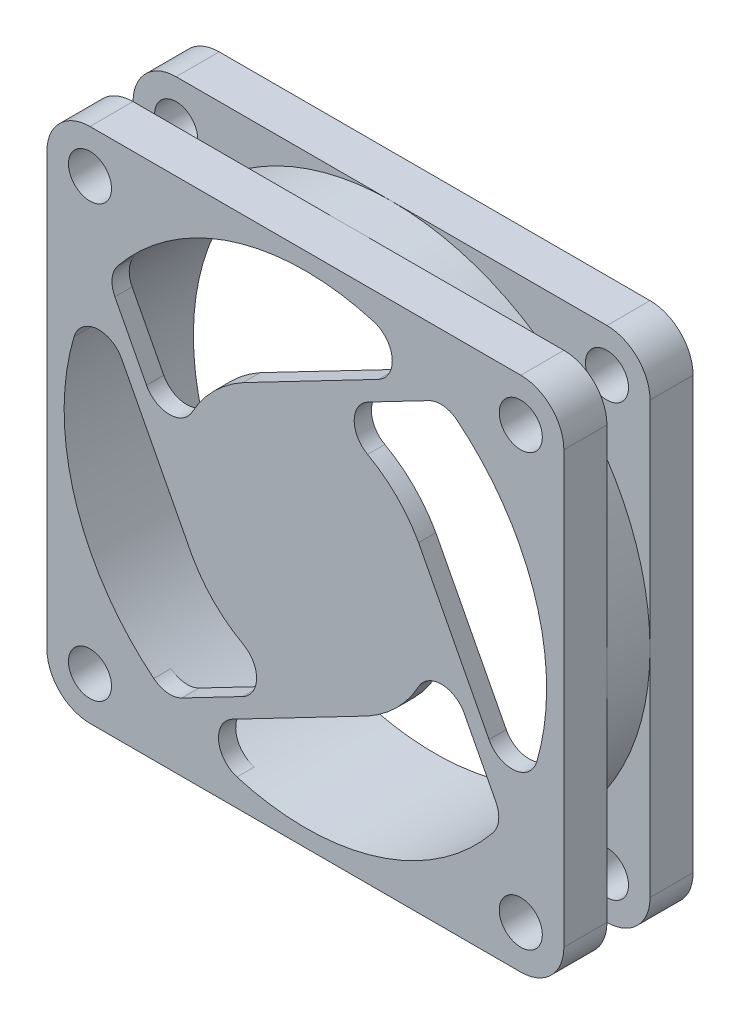
from build123d import *

# Parameters (mm, degrees)
SKETCH1_W           = 60
SKETCH1_H           = 60
SKETCH1_R           = 28
SKETCH1_R_2         = 2.5
BOSS_EXTRUDE1_DEPTH = 7.5
SKETCH2_W           = 83.422483418
SKETCH2_H           = 79.797227822
SKETCH2_R           = 30
CUT_EXTRUDE1_DEPTH  = 2.5
BOSS_EXTRUDE2_START = -2
BOSS_EXTRUDE2_DEPTH = 2
FILLET1_R           = 3
FILLET2_R           = 5


with BuildPart() as part:
    # Sketch1 → Boss-Extrude1 (new, symmetric)
    with BuildSketch(Plane.XY):
        Rectangle(SKETCH1_W, SKETCH1_H)
        Circle(SKETCH1_R, mode=Mode.SUBTRACT)
        with Locations((25, 25)):
            Circle(SKETCH1_R_2, mode=Mode.SUBTRACT)
        with Locations((-25, 25)):
            Circle(SKETCH1_R_2, mode=Mode.SUBTRACT)
        with Locations((-25, -25)):
            Circle(SKETCH1_R_2, mode=Mode.SUBTRACT)
        with Locations((25, -25)):
            Circle(SKETCH1_R_2, mode=Mode.SUBTRACT)
    extrude(amount=BOSS_EXTRUDE1_DEPTH, both=True)

    # Sketch2 → Cut-Extrude1 (cut, symmetric)
    with BuildSketch(Plane.XY):
        Rectangle(SKETCH2_W, SKETCH2_H)
        Circle(SKETCH2_R, mode=Mode.SUBTRACT)
    extrude(amount=CUT_EXTRUDE1_DEPTH, both=True, mode=Mode.SUBTRACT)

    # Sketch3 → Boss-Extrude2 (add)
    with BuildSketch(Plane.XY.offset(7.5).offset(BOSS_EXTRUDE2_START)):
        with BuildLine():
            Line((14.986146269, -0.644530834), (22.978250586, -16))
            ThreePointArc((22.978250586, -16), (23.61864626, -15.038601957), (24.218842251, -14.051607738))
            Line((24.218842251, -14.051607738), (13.465479299, 6.609150267))
            Line((13.465479299, 6.609150267), (13.13845395, 7.237473855))
            ThreePointArc((13.13845395, 7.237473855), (7.905893272, 12.747425292), (0.644530834, 14.986146269))
            Line((0.644530834, 14.986146269), (16, 22.978250586))
            ThreePointArc((16, 22.978250586), (15.038601957, 23.61864626), (14.051607738, 24.218842251))
            Line((14.051607738, 24.218842251), (-7.237473855, 13.13845395))
            ThreePointArc((-7.237473855, 13.13845395), (-12.747425292, 7.905893272), (-14.986146269, 0.644530834))
            Line((-14.986146269, 0.644530834), (-22.978250586, 16))
            ThreePointArc((-22.978250586, 16), (-23.61864626, 15.038601957), (-24.218842251, 14.051607738))
            Line((-24.218842251, 14.051607738), (-13.465479299, -6.609150267))
            Line((-13.465479299, -6.609150267), (-13.13845395, -7.237473855))
            ThreePointArc((-13.13845395, -7.237473855), (-7.905893272, -12.747425292), (-0.644530834, -14.986146269))
            Line((-0.644530834, -14.986146269), (-16, -22.978250586))
            ThreePointArc((-16, -22.978250586), (-15.038601957, -23.61864626), (-14.051607738, -24.218842251))
            Line((-14.051607738, -24.218842251), (6.609150267, -13.465479299))
            Line((6.609150267, -13.465479299), (7.237473855, -13.13845395))
            ThreePointArc((7.237473855, -13.13845395), (12.747425292, -7.905893272), (14.986146269, -0.644530834))
        make_face()
    extrude(amount=BOSS_EXTRUDE2_DEPTH)

    # Fillet1
    fillet1_edges = [part.edges().sort_by_distance(p)[0] for p in [
        (24.218842251, -14.051607738, 6.5),
        (22.978250586, -16, 6.5),
        (14.986146269, -0.644530834, 6.5),
        (-14.051607738, -24.218842251, 6.5),
        (-16, -22.978250586, 6.5),
        (-0.644530834, -14.986146269, 6.5),
        (-24.218842251, 14.051607738, 6.5),
        (-22.978250586, 16, 6.5),
        (-14.986146269, 0.644530834, 6.5),
        (14.051607738, 24.218842251, 6.5),
        (16, 22.978250586, 6.5),
        (0.644530834, 14.986146269, 6.5),
    ]]
    fillet(fillet1_edges, radius=FILLET1_R)

    # Fillet2
    fillet2_edges = [part.edges().sort_by_distance(p)[0] for p in [
        (30, -30, -5),
        (-30, -30, -5),
        (-30, 30, -5),
        (30, 30, -5),
        (30, -30, 5),
        (-30, -30, 5),
        (-30, 30, 5),
        (30, 30, 5),
    ]]
    fillet(fillet2_edges, radius=FILLET2_R)


solid = part.part
